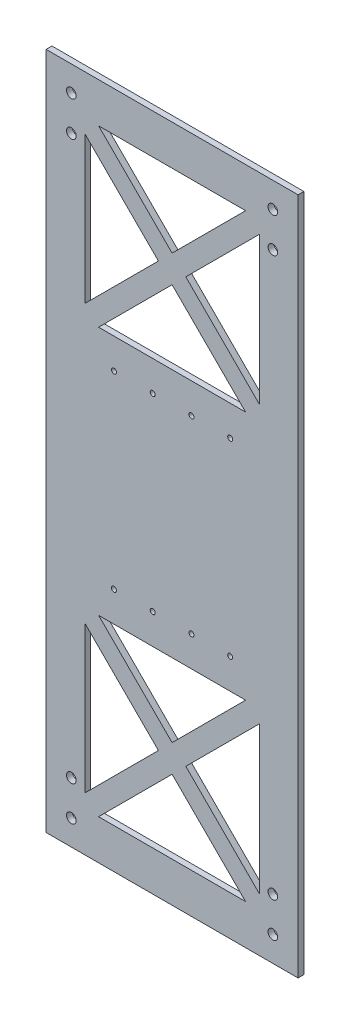
from build123d import *

# Parameters (mm, degrees)
SKETCH_1_W      = 130
SKETCH_1_H      = 350
SKETCH_1_R      = 1.3
SKETCH_1_R_2    = 2.5
EXTRUDE_1_DEPTH = 3


with BuildPart() as part:
    # 草圖1 → 填料-伸長1 (new body)
    with BuildSketch(Plane.XY):
        Rectangle(SKETCH_1_W, SKETCH_1_H)
        with Locations((-30, 48.75)):
            Circle(SKETCH_1_R, mode=Mode.SUBTRACT)
        with Locations((-10, 48.75)):
            Circle(SKETCH_1_R, mode=Mode.SUBTRACT)
        with Locations((10, 48.75)):
            Circle(SKETCH_1_R, mode=Mode.SUBTRACT)
        with Locations((30, 48.75)):
            Circle(SKETCH_1_R, mode=Mode.SUBTRACT)
        with Locations((-30, -48.75)):
            Circle(SKETCH_1_R, mode=Mode.SUBTRACT)
        with Locations((-10, -48.75)):
            Circle(SKETCH_1_R, mode=Mode.SUBTRACT)
        with Locations((10, -48.75)):
            Circle(SKETCH_1_R, mode=Mode.SUBTRACT)
        with Locations((30, -48.75)):
            Circle(SKETCH_1_R, mode=Mode.SUBTRACT)
        with Locations((-52, -162)):
            Circle(SKETCH_1_R_2, mode=Mode.SUBTRACT)
        with Locations((-52, -144)):
            Circle(SKETCH_1_R_2, mode=Mode.SUBTRACT)
        with Locations((52, -144)):
            Circle(SKETCH_1_R_2, mode=Mode.SUBTRACT)
        with Locations((52, -162)):
            Circle(SKETCH_1_R_2, mode=Mode.SUBTRACT)
        with Locations((52, 162)):
            Circle(SKETCH_1_R_2, mode=Mode.SUBTRACT)
        with Locations((52, 144)):
            Circle(SKETCH_1_R_2, mode=Mode.SUBTRACT)
        with Locations((-52, 162)):
            Circle(SKETCH_1_R_2, mode=Mode.SUBTRACT)
        with Locations((-52, 144)):
            Circle(SKETCH_1_R_2, mode=Mode.SUBTRACT)
        Polygon((-37.928932188, -64.375), (37.928932188, -64.375), (0, -102.303932188), align=None, mode=Mode.SUBTRACT)
        Polygon((-7.071067812, -109.375), (-45, -71.446067812), (-45, -147.303932188), align=None, mode=Mode.SUBTRACT)
        Polygon((0, -116.446067812), (37.928932188, -154.375), (-37.928932188, -154.375), align=None, mode=Mode.SUBTRACT)
        Polygon((7.071067812, -109.375), (45, -71.446067812), (45, -147.303932188), align=None, mode=Mode.SUBTRACT)
        Polygon((-37.928932188, 154.375), (37.928932188, 154.375), (0, 116.446067812), align=None, mode=Mode.SUBTRACT)
        Polygon((-45, 147.303932188), (-7.071067812, 109.375), (-45, 71.446067812), align=None, mode=Mode.SUBTRACT)
        Polygon((0, 102.303932188), (-37.928932188, 64.375), (37.928932188, 64.375), align=None, mode=Mode.SUBTRACT)
        Polygon((7.071067812, 109.375), (45, 147.303932188), (45, 71.446067812), align=None, mode=Mode.SUBTRACT)
    extrude(amount=EXTRUDE_1_DEPTH)


solid = part.part
